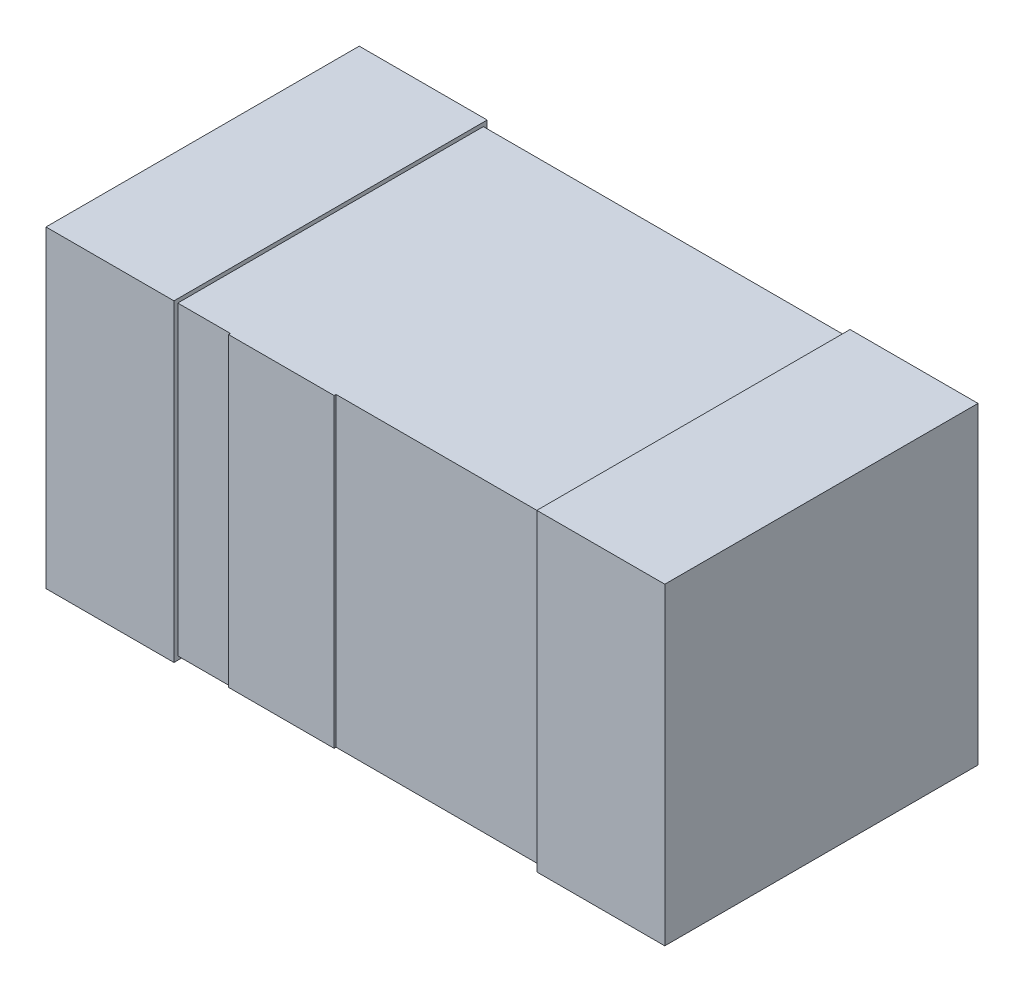
from build123d import *

# Parameters (mm, degrees)
SKETCH1_W           = 3.2
SKETCH1_H           = 1.6
BOSS_EXTRUDE1_DEPTH = 1.6
BOSS_EXTRUDE2_START = -0.65
SKETCH2_W           = 1.64
SKETCH2_H           = 1.64
BOSS_EXTRUDE2_DEPTH = 0.67
SKETCH3_W           = 0.5525
SKETCH3_H           = 1.6
BOSS_EXTRUDE3_DEPTH = 0.01


with BuildPart() as part:
    # Sketch1 → Boss-Extrude1 (new body)
    with BuildSketch(Plane.XY):
        Rectangle(SKETCH1_W, SKETCH1_H)
    extrude(amount=BOSS_EXTRUDE1_DEPTH)

    # Sketch2 → Boss-Extrude2 (add)
    with BuildSketch(Plane(origin=(1.6, 0, 0), x_dir=(0, 0, -1), z_dir=(1, 0, 0)).offset(BOSS_EXTRUDE2_START)):
        with Locations((-0.8, 0)):
            Rectangle(SKETCH2_W, SKETCH2_H)
    boss_extrude2 = extrude(amount=BOSS_EXTRUDE2_DEPTH)

    # Mirror1: Boss-Extrude2 across plane
    add(boss_extrude2.mirror(Plane(origin=(0, 0, 0), x_dir=(0, 0, 1), z_dir=(1, 0, 0))))

    # Sketch3 → Boss-Extrude3 (add)
    with BuildSketch(Plane.XY.offset(1.6)):
        with Locations((-0.3975, 0)):
            Rectangle(SKETCH3_W, SKETCH3_H)
    extrude(amount=BOSS_EXTRUDE3_DEPTH)


solid = part.part
